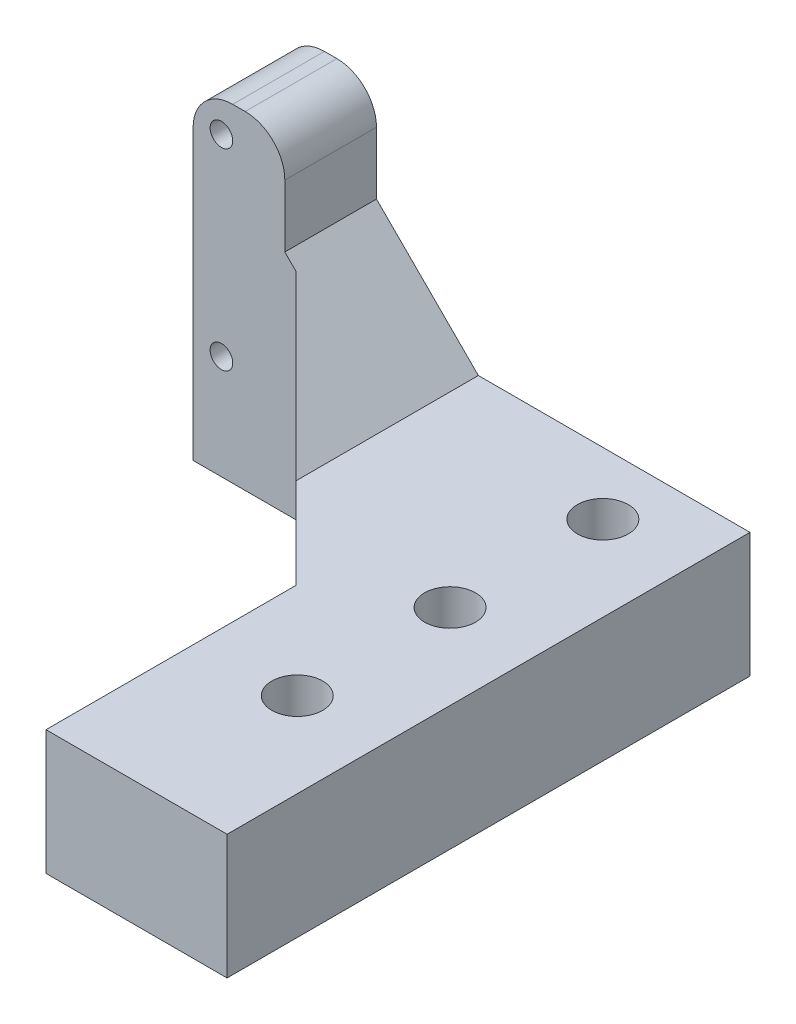
from build123d import *

# Parameters (mm, degrees)
ESQUISSE1_W                  = 18
ESQUISSE1_H                  = 29
BOSS_EXTRU_1_DEPTH           = 46.2
ESQUISSE3_R                  = 1
ENL_V_MAT_EXTRU_1_DEPTH      = 58.440752084
ESQUISSE4_W                  = 18
ESQUISSE4_H                  = 30
ENL_V_MAT_EXTRU_2_DEPTH      = 58.440752084
ESQUISSE5_W                  = 8.1
ESQUISSE5_H                  = 46.2
BOSS_EXTRU_2_DEPTH           = 29
CONG_1_R                     = 3.5
ENL_V_START                  = -46.2
ESQUISSE7_W                  = 18
ESQUISSE7_H                  = 18
ENL_V_MAT_EXTRU_4_DEPTH      = 46.2
ESQUISSE8_W                  = 15
ESQUISSE8_H                  = 46.2
ESQUISSE8_R                  = 2.25
BOSS_EXTRU_3_DEPTH           = 11
CHANFREIN1_SIZE              = 9
CONG_2_R                     = 3.5
ENL_V_MAT_EXTRU_5_DEPTH      = 65.402251513
ENL_V_MAT_EXTRU_5_DEPTH_BACK = 65.402251513
ESQUISSE9_W                  = 25.1
ESQUISSE9_H                  = 38.1
CHANFREIN2_SIZE              = 16


with BuildPart() as part:
    # Esquisse1 → Boss.-Extru.1 (new body)
    with BuildSketch(Plane.XY):
        with Locations((9, 14.5)):
            Rectangle(ESQUISSE1_W, ESQUISSE1_H)
    extrude(amount=BOSS_EXTRU_1_DEPTH)

    # Esquisse3 → Enlèv. mat.-Extru.1 (cut, through all)
    with BuildSketch(Plane.XY.offset(46.2)):
        with Locations((2.5, 26.2)):
            Circle(ESQUISSE3_R)
        with Locations((2.5, 9.2)):
            Circle(ESQUISSE3_R)
    extrude(amount=-ENL_V_MAT_EXTRU_1_DEPTH, mode=Mode.SUBTRACT)

    # Esquisse4 → Enlèv. mat.-Extru.2 (cut, through all)
    with BuildSketch(Plane(origin=(0, 29, 0), x_dir=(1, 0, 0), z_dir=(0, 1, 0))):
        with Locations((9, -23.1)):
            Rectangle(ESQUISSE4_W, ESQUISSE4_H)
    extrude(amount=-ENL_V_MAT_EXTRU_2_DEPTH, mode=Mode.SUBTRACT)


with BuildPart() as enl_v_mat_extru_2_piece_1:
    # of the separate pieces the step leaves, piece 1, a body of its own (enl_v_mat_extru_2_pieces)
    add(part.part.solids().sort_by_distance((0, 0, 0))[0])



with BuildPart() as enl_v_mat_extru_2_piece_2:
    # of the separate pieces the step leaves, piece 2, a body of its own (enl_v_mat_extru_2_pieces)
    add(part.part.solids().sort_by_distance((18, 0, 38.1))[0])


with BuildPart() as enl_v_mat_extru_2_piece_1_1:
    add(enl_v_mat_extru_2_piece_1.part)

    add(enl_v_mat_extru_2_piece_2.part)  # Boss.-Extru.2 merges Enlèv. mat.-Extru.2 piece 2
    # Esquisse5 → Boss.-Extru.2 (add)
    with BuildSketch(Plane(origin=(0, 29, 0), x_dir=(1, 0, 0), z_dir=(0, 1, 0))):
        with Locations((22.05, -23.1)):
            Rectangle(ESQUISSE5_W, ESQUISSE5_H)
    extrude(amount=-BOSS_EXTRU_2_DEPTH)

    # Congé1
    cong_1_edges = [enl_v_mat_extru_2_piece_1_1.edges().sort_by_distance(p)[0] for p in [
        (0, 29, 42.15),
        (0, 29, 4.05),
    ]]
    fillet(cong_1_edges, radius=CONG_1_R)

    # Esquisse7 → Enlèv. mat.-Extru.4 (cut)
    with BuildSketch(Plane(origin=(0, 0, 0), x_dir=(-1, 0, 0), z_dir=(0, 0, -1)).offset(ENL_V_START)):
        with Locations((-17.1, 20)):
            Rectangle(ESQUISSE7_W, ESQUISSE7_H)
    extrude(amount=ENL_V_MAT_EXTRU_4_DEPTH, mode=Mode.SUBTRACT)

    # Esquisse8 → Boss.-Extru.3 (add)
    with BuildSketch(Plane(origin=(0, 11, 0), x_dir=(1, 0, 0), z_dir=(0, 1, 0))):
        with Locations((33.6, -23.1)):
            Rectangle(ESQUISSE8_W, ESQUISSE8_H)
        with Locations(Location((33.6, -5.5, 0), (0, 0, 270))):
            Circle(ESQUISSE8_R, mode=Mode.SUBTRACT)
        with Locations(Location((33.6, -32.5, 0), (0, 0, 270))):
            Circle(ESQUISSE8_R, mode=Mode.SUBTRACT)
        with Locations(Location((33.6, -19, 0), (0, 0, 270))):
            Circle(ESQUISSE8_R, mode=Mode.SUBTRACT)
    extrude(amount=-BOSS_EXTRU_3_DEPTH)

    # Chanfrein1
    chanfrein1_edges = [enl_v_mat_extru_2_piece_1_1.edges().sort_by_distance(p)[0] for p in [
        (8.1, 11, 42.15),
        (8.1, 11, 4.05),
    ]]
    chamfer(chanfrein1_edges, length=CHANFREIN1_SIZE)

    # Congé2
    cong_2_edges = [enl_v_mat_extru_2_piece_1_1.edges().sort_by_distance(p)[0] for p in [
        (8.1, 29, 42.15),
        (8.1, 29, 4.05),
    ]]
    fillet(cong_2_edges, radius=CONG_2_R)

    # Esquisse9 → Enlèv. mat.-Extru.5 (cut, two sides: drawn at the far end of the back side and taken through both)
    with BuildSketch(Plane(origin=(0, 11, 0), x_dir=(1, 0, 0), z_dir=(0, 1, 0)).offset(-ENL_V_MAT_EXTRU_5_DEPTH_BACK)):
        with Locations((12.55, -27.15)):
            Rectangle(ESQUISSE9_W, ESQUISSE9_H)
    extrude(amount=ENL_V_MAT_EXTRU_5_DEPTH + ENL_V_MAT_EXTRU_5_DEPTH_BACK, mode=Mode.SUBTRACT)

    # Chanfrein2
    chanfrein2_edges = [enl_v_mat_extru_2_piece_1_1.edges().sort_by_distance(p)[0] for p in [
        (25.1, 5.5, 8.1),
    ]]
    chamfer(chanfrein2_edges, length=CHANFREIN2_SIZE)


solid = enl_v_mat_extru_2_piece_1_1.part
